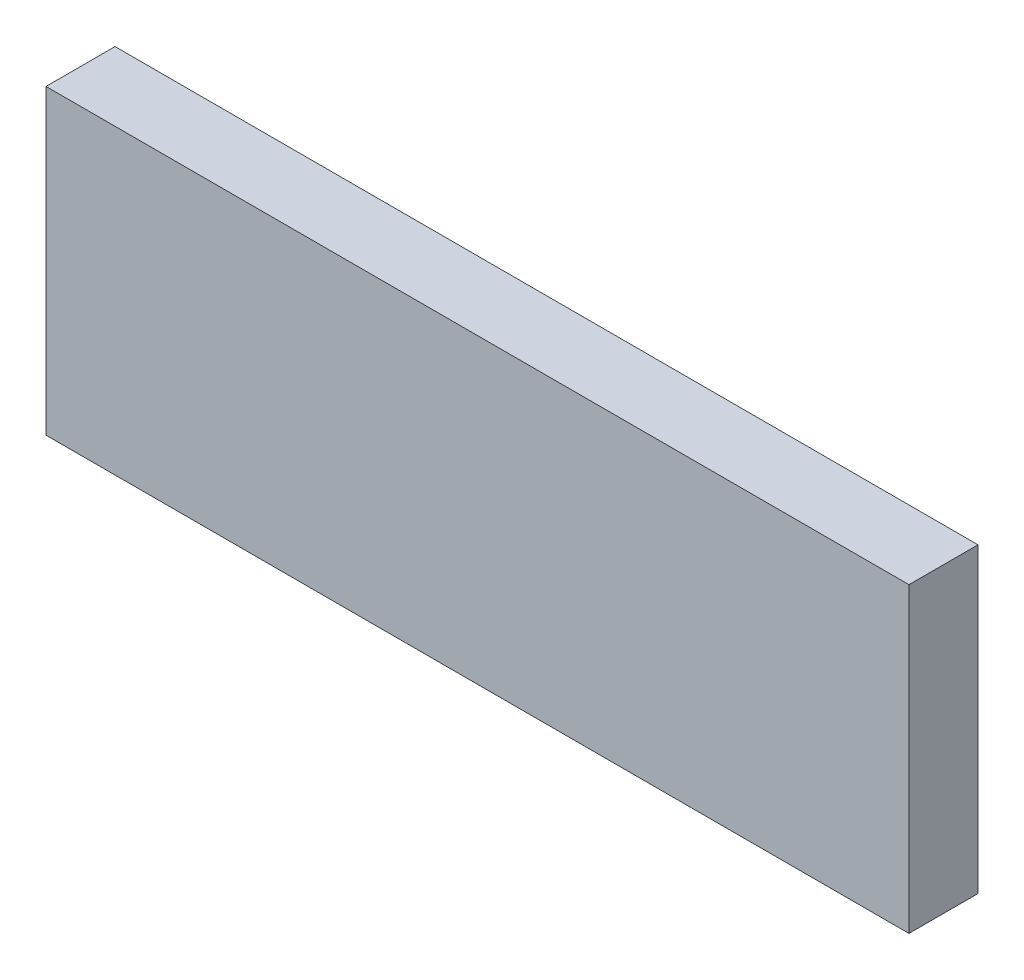
from build123d import *

# Parameters (mm, degrees)
SKETCH1_W           = 200
SKETCH1_H           = 70
BOSS_EXTRUDE1_DEPTH = 16


with BuildPart() as part:
    # Sketch1 → Boss-Extrude1 (new body)
    with BuildSketch(Plane.XY):
        with Locations((100, 35)):
            Rectangle(SKETCH1_W, SKETCH1_H)
    extrude(amount=BOSS_EXTRUDE1_DEPTH)


solid = part.part
